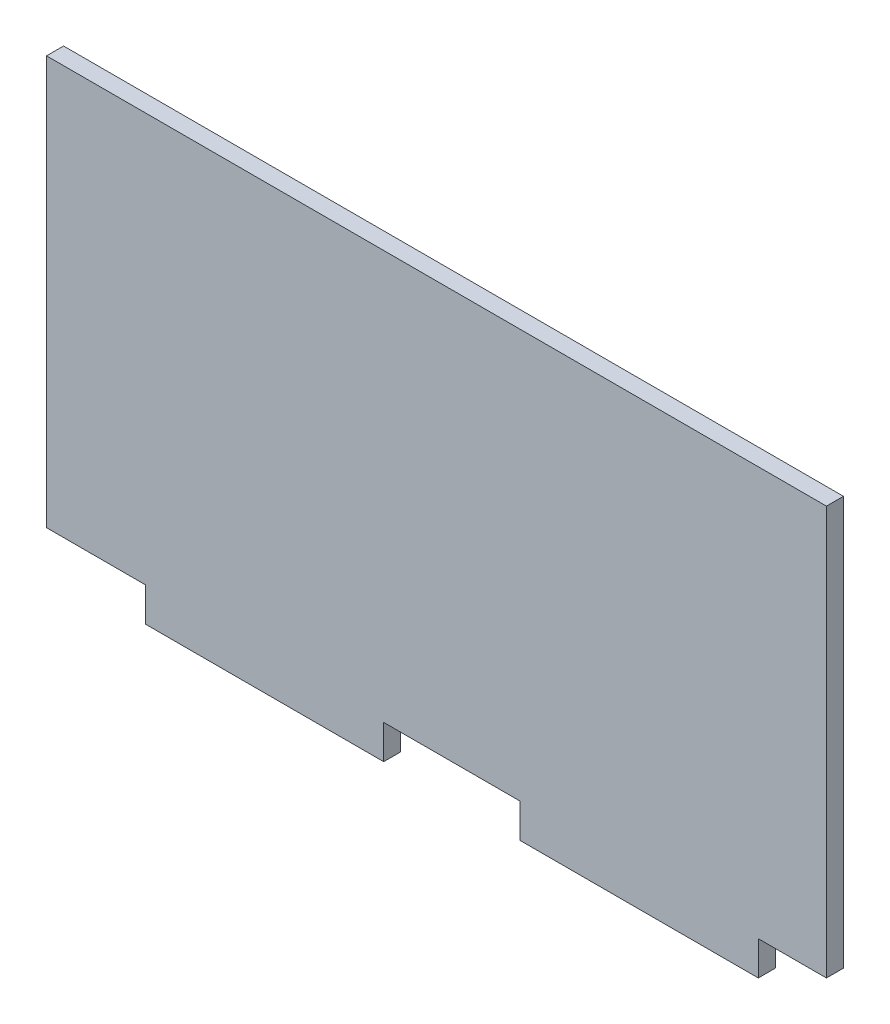
from build123d import *

# Parameters (mm, degrees)
BOSS_EXTRU_1_DEPTH = 5


with BuildPart() as part:
    # Esquisse1 → Boss.-Extru.1 (new body)
    with BuildSketch(Plane.XY):
        Polygon((-84.623987034, 0), (-55.623987034, 0), (-55.623987034, -10), (14.376012966, -10), (14.376012966, 0), (54.376012966, 0), (54.376012966, -10), (124.376012966, -10), (124.376012966, 0), (144.376012966, 0), (144.376012966, 120), (-84.623987034, 120), align=None)
    extrude(amount=BOSS_EXTRU_1_DEPTH)


solid = part.part
